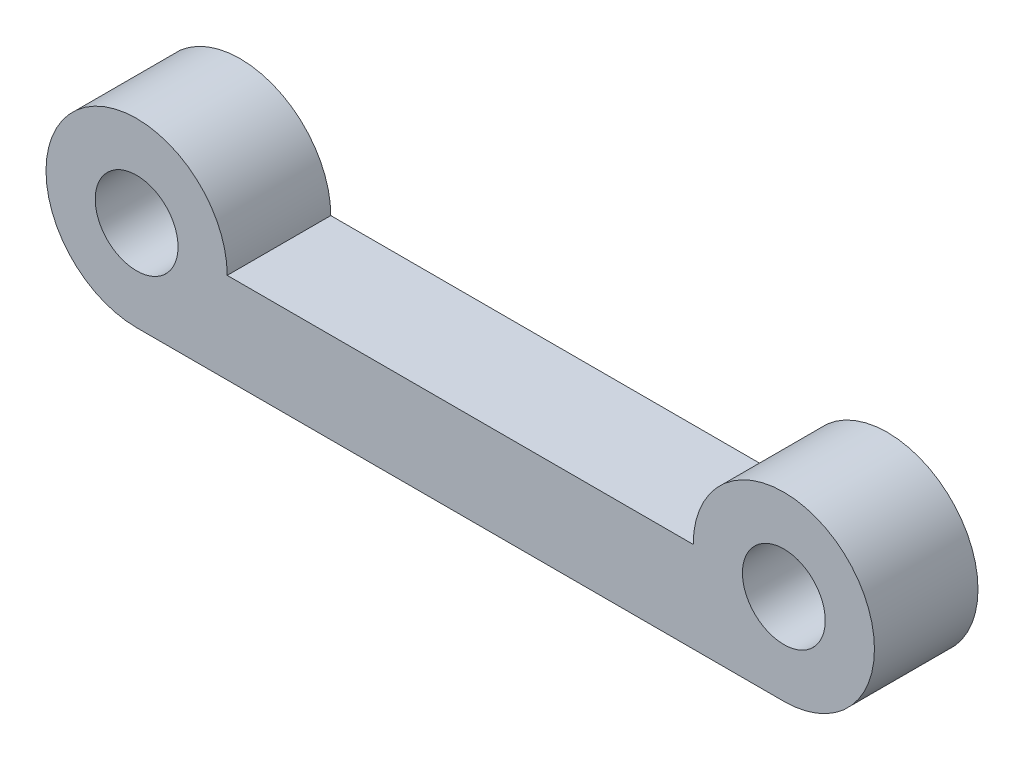
from build123d import *

# Parameters (mm, degrees)
SKETCH_1_R      = 1.6
EXTRUDE_1_DEPTH = 4


with BuildPart() as part:
    # ｽｹｯﾁ1 → ﾎﾞｽ - 押し出し1 (new body)
    with BuildSketch(Plane.XY):
        with BuildLine():
            Line((0, -3.5), (25, -3.5))
            ThreePointArc((25, -3.5), (27.474873734, 2.474873734), (21.5, 0))
            Line((21.5, 0), (3.5, 0))
            ThreePointArc((3.5, 0), (-2.474873734, 2.474873734), (0, -3.5))
        make_face()
        Circle(SKETCH_1_R, mode=Mode.SUBTRACT)
        with Locations((25, 0)):
            Circle(SKETCH_1_R, mode=Mode.SUBTRACT)
    extrude(amount=EXTRUDE_1_DEPTH)


solid = part.part
